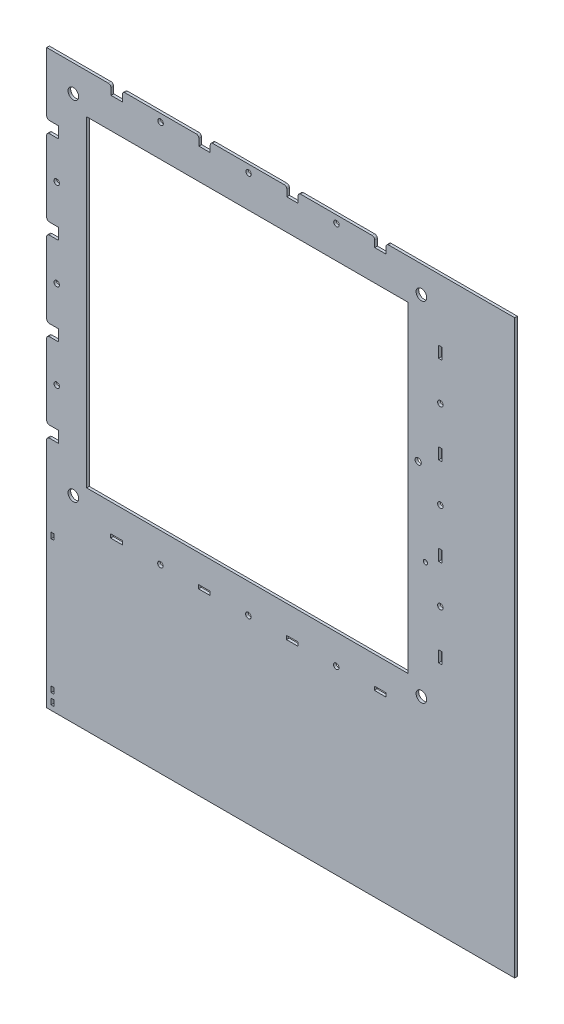
from build123d import *

# Parameters (mm, degrees)
SKETCH_1_R          = 2.05
SKETCH_1_R_2        = 4
SKETCH_1_R_3        = 2.332988974
SKETCH_1_R_4        = 1.601067765
SKETCH_1_W          = 8.8
SKETCH_1_H          = 2.8
SKETCH_1_W_2        = 2.5
SKETCH_1_H_2        = 8.5
SKETCH_1_W_3        = 8.5
SKETCH_1_H_3        = 2.5
SKETCH_1_W_4        = 241.301375666
SKETCH_1_H_4        = 241.301375666
SKETCH_1_W_5        = 2.3
SKETCH_1_H_5        = 4.3
EXTRUDE_1_DEPTH     = 2
SKETCH_2_W          = 15.371335927
SKETCH_2_H          = 8.514117998
SKETCH_2_W_2        = 8.829080761
SKETCH_2_H_2        = 8.5
SKETCH_2_W_3        = 10.335603127
SKETCH_2_W_4        = 8.5
SKETCH_2_H_3        = 5.29768324
SKETCH_2_H_4        = 6.445558592
SKETCH_2_H_5        = 5.884818728
CUT_EXTRUDE_1_DEPTH = 2
FILLET_1_R          = 2


with BuildPart() as part:
    # 草图1 → 凸台-拉伸1 (new body)
    with BuildSketch(Plane.XY):
        Polygon((-150.650687833, -150.650687833), (-150.650687833, 150.650687833), (150.650687833, 150.650687833), (200.650687833, 150.650687833), (200.650687833, -278.650687833), (150.650687833, -278.650687833), (-150.650687833, -278.650687833), align=None)
        with Locations((0.724285714, -142.895)):
            Circle(SKETCH_1_R, mode=Mode.SUBTRACT)
        with Locations((66.724285714, -142.895)):
            Circle(SKETCH_1_R, mode=Mode.SUBTRACT)
        with Locations((-65.275714286, -142.895)):
            Circle(SKETCH_1_R, mode=Mode.SUBTRACT)
        with Locations((-143.125714286, 66.955)):
            Circle(SKETCH_1_R, mode=Mode.SUBTRACT)
        with Locations((-143.125714286, 0.955)):
            Circle(SKETCH_1_R, mode=Mode.SUBTRACT)
        with Locations((-143.125714286, -65.045)):
            Circle(SKETCH_1_R, mode=Mode.SUBTRACT)
        with Locations((66.874285714, 144.955)):
            Circle(SKETCH_1_R, mode=Mode.SUBTRACT)
        with Locations((0.874285714, 144.955)):
            Circle(SKETCH_1_R, mode=Mode.SUBTRACT)
        with Locations((-65.125714286, 144.955)):
            Circle(SKETCH_1_R, mode=Mode.SUBTRACT)
        with Locations((144.874285714, -65.045)):
            Circle(SKETCH_1_R, mode=Mode.SUBTRACT)
        with Locations((144.874285714, 0.955)):
            Circle(SKETCH_1_R, mode=Mode.SUBTRACT)
        with Locations((144.874285714, 66.955)):
            Circle(SKETCH_1_R, mode=Mode.SUBTRACT)
        with Locations((-130.650687833, -130.650687833)):
            Circle(SKETCH_1_R_2, mode=Mode.SUBTRACT)
        with Locations((-130.650687833, 130.650687833)):
            Circle(SKETCH_1_R_2, mode=Mode.SUBTRACT)
        with Locations((130.650687833, 130.650687833)):
            Circle(SKETCH_1_R_2, mode=Mode.SUBTRACT)
        with Locations((130.650687833, -130.650687833)):
            Circle(SKETCH_1_R_2, mode=Mode.SUBTRACT)
        with Locations((128.234921063, 21.045946403)):
            Circle(SKETCH_1_R_3, mode=Mode.SUBTRACT)
        with Locations((133.709191973, -41.76906745)):
            Circle(SKETCH_1_R_4, mode=Mode.SUBTRACT)
        with Locations((99.724285714, -142.895)):
            Rectangle(SKETCH_1_W, SKETCH_1_H, mode=Mode.SUBTRACT)
        with Locations((33.724285714, -142.895)):
            Rectangle(SKETCH_1_W, SKETCH_1_H, mode=Mode.SUBTRACT)
        with Locations((-32.275714286, -142.895)):
            Rectangle(SKETCH_1_W, SKETCH_1_H, mode=Mode.SUBTRACT)
        with Locations((-98.275714286, -142.895)):
            Rectangle(SKETCH_1_W, SKETCH_1_H, mode=Mode.SUBTRACT)
        with Locations((-143.125714286, 99.955)):
            Rectangle(SKETCH_1_W_2, SKETCH_1_H_2, mode=Mode.SUBTRACT)
        with Locations((-143.125714286, 33.955)):
            Rectangle(SKETCH_1_W_2, SKETCH_1_H_2, mode=Mode.SUBTRACT)
        with Locations((-143.125714286, -32.045)):
            Rectangle(SKETCH_1_W_2, SKETCH_1_H_2, mode=Mode.SUBTRACT)
        with Locations((-143.125714286, -98.045)):
            Rectangle(SKETCH_1_W_2, SKETCH_1_H_2, mode=Mode.SUBTRACT)
        with Locations((99.874285714, 144.955)):
            Rectangle(SKETCH_1_W_3, SKETCH_1_H_3, mode=Mode.SUBTRACT)
        with Locations((33.874285714, 144.955)):
            Rectangle(SKETCH_1_W_3, SKETCH_1_H_3, mode=Mode.SUBTRACT)
        with Locations((-32.125714286, 144.955)):
            Rectangle(SKETCH_1_W_3, SKETCH_1_H_3, mode=Mode.SUBTRACT)
        with Locations((-98.125714286, 144.955)):
            Rectangle(SKETCH_1_W_3, SKETCH_1_H_3, mode=Mode.SUBTRACT)
        with Locations((144.874285714, -98.045)):
            Rectangle(SKETCH_1_W_2, SKETCH_1_H_2, mode=Mode.SUBTRACT)
        with Locations((144.874285714, -32.045)):
            Rectangle(SKETCH_1_W_2, SKETCH_1_H_2, mode=Mode.SUBTRACT)
        with Locations((144.874285714, 33.955)):
            Rectangle(SKETCH_1_W_2, SKETCH_1_H_2, mode=Mode.SUBTRACT)
        with Locations((144.874285714, 99.955)):
            Rectangle(SKETCH_1_W_2, SKETCH_1_H_2, mode=Mode.SUBTRACT)
        Rectangle(SKETCH_1_W_4, SKETCH_1_H_4, mode=Mode.SUBTRACT)
        with Locations((-146.175714286, -272.895)):
            Rectangle(SKETCH_1_W_5, SKETCH_1_H_5, mode=Mode.SUBTRACT)
        with Locations((-146.175714286, -264.895)):
            Rectangle(SKETCH_1_W_5, SKETCH_1_H_5, mode=Mode.SUBTRACT)
        with Locations((-146.175714286, -164.895)):
            Rectangle(SKETCH_1_W_5, SKETCH_1_H_5, mode=Mode.SUBTRACT)
    extrude(amount=EXTRUDE_1_DEPTH)

    # 草图2 → 切除-拉伸1 (cut)
    with BuildSketch(Plane.XY.offset(2)):
        with Locations((-152.06138225, -98.037941001)):
            Rectangle(SKETCH_2_W, SKETCH_2_H)
        with Locations((-148.790254667, -32.045)):
            Rectangle(SKETCH_2_W_2, SKETCH_2_H_2)
        with Locations((-149.54351585, 33.955)):
            Rectangle(SKETCH_2_W_3, SKETCH_2_H_2)
        with Locations((-149.54351585, 99.955)):
            Rectangle(SKETCH_2_W_3, SKETCH_2_H_2)
        with Locations((-98.125714286, 148.85384162)):
            Rectangle(SKETCH_2_W_4, SKETCH_2_H_3)
        with Locations((-32.125714286, 149.427779296)):
            Rectangle(SKETCH_2_W_4, SKETCH_2_H_4)
        with Locations((33.874285714, 149.427779296)):
            Rectangle(SKETCH_2_W_4, SKETCH_2_H_4)
        with Locations((99.874285714, 149.147409364)):
            Rectangle(SKETCH_2_W_4, SKETCH_2_H_5)
    extrude(amount=-CUT_EXTRUDE_1_DEPTH, mode=Mode.SUBTRACT)

    # 圆角1
    fillet_1_edges = [part.edges().sort_by_distance(p)[0] for p in [
        (-150.650687833, -102.295, 1),
        (-150.650687833, -93.780882002, 1),
        (-150.650687833, -36.295, 1),
        (-150.650687833, -27.795, 1),
        (-150.650687833, 29.705, 1),
        (-150.650687833, 38.205, 1),
        (-150.650687833, 95.705, 1),
        (-150.650687833, 104.205, 1),
        (-102.375714286, 150.650687833, 1),
        (-93.875714286, 150.650687833, 1),
        (-36.375714286, 150.650687833, 1),
        (-27.875714286, 150.650687833, 1),
        (29.624285714, 150.650687833, 1),
        (38.124285714, 150.650687833, 1),
        (95.624285714, 150.650687833, 1),
        (104.124285714, 150.650687833, 1),
    ]]
    fillet(fillet_1_edges, radius=FILLET_1_R)


solid = part.part
